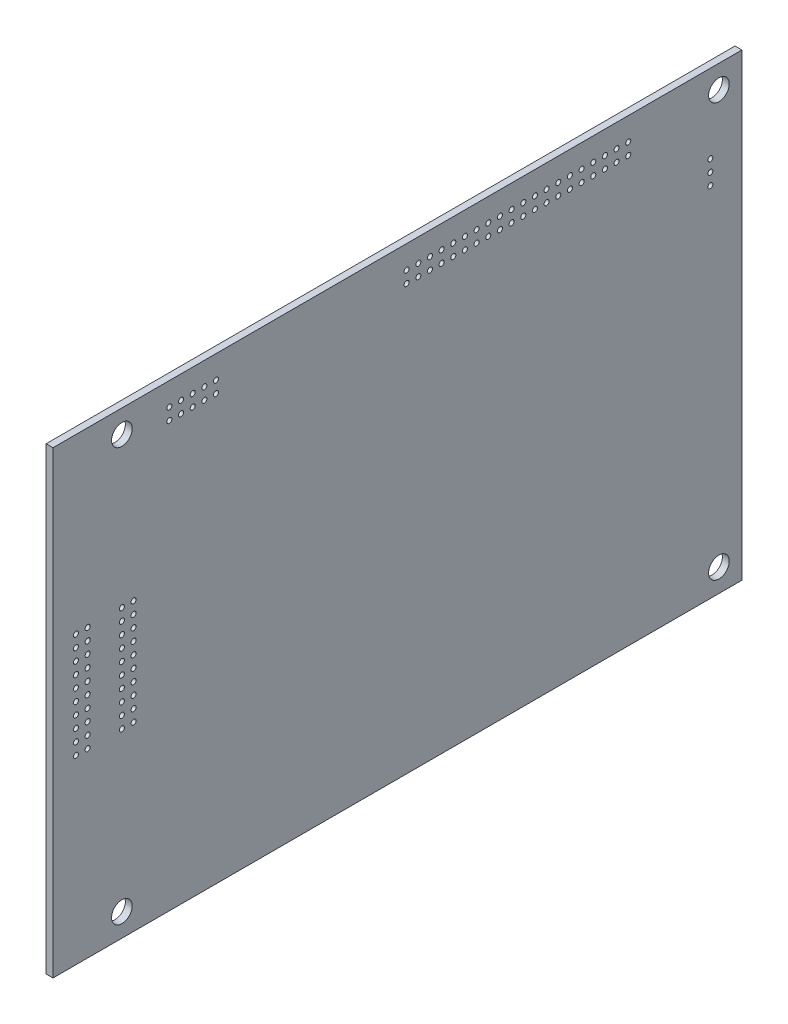
from build123d import *

# Parameters (mm, degrees)
SKETCH_1_W          = 150
SKETCH_1_H          = 100
SKETCH_1_R          = 2.25
EXTRUDE_1_DEPTH     = 1.5
SKETCH_2_R          = 0.55
CUT_EXTRUDE_1_DEPTH = 10


with BuildPart() as part:
    # Эскиз1 → Вытянуть1 (new body)
    with BuildSketch(Plane(origin=(0, 0, 0), x_dir=(0, 0, -1), z_dir=(1, 0, 0))):
        Rectangle(SKETCH_1_W, SKETCH_1_H)
        with Locations((-60, 45)):
            Circle(SKETCH_1_R, mode=Mode.SUBTRACT)
        with Locations((-60, -45)):
            Circle(SKETCH_1_R, mode=Mode.SUBTRACT)
        with Locations(Location((70, -45, 0), (0, 0, 180))):
            Circle(SKETCH_1_R, mode=Mode.SUBTRACT)
        with Locations(Location((70, 45, 0), (0, 0, 180))):
            Circle(SKETCH_1_R, mode=Mode.SUBTRACT)
    extrude(amount=EXTRUDE_1_DEPTH)

    # Эскиз2 → Вырез-Вытянуть1 (cut)
    with BuildSketch(Plane(origin=(1.5, 0, 0), x_dir=(0, 0, -1), z_dir=(1, 0, 0))):
        with Locations((-70, 12.335)):
            Circle(SKETCH_2_R)
        with Locations((-67.46, 12.335)):
            Circle(SKETCH_2_R)
        with Locations((-70, 9.795)):
            Circle(SKETCH_2_R)
        with Locations((-67.46, 9.795)):
            Circle(SKETCH_2_R)
        with Locations((-70, 7.255)):
            Circle(SKETCH_2_R)
        with Locations((-67.46, 7.255)):
            Circle(SKETCH_2_R)
        with Locations((-70, 4.715)):
            Circle(SKETCH_2_R)
        with Locations((-67.46, 4.715)):
            Circle(SKETCH_2_R)
        with Locations((-70, 2.175)):
            Circle(SKETCH_2_R)
        with Locations((-67.46, 2.175)):
            Circle(SKETCH_2_R)
        with Locations((-70, -0.365)):
            Circle(SKETCH_2_R)
        with Locations((-67.46, -0.365)):
            Circle(SKETCH_2_R)
        with Locations((-70, -2.905)):
            Circle(SKETCH_2_R)
        with Locations((-67.46, -2.905)):
            Circle(SKETCH_2_R)
        with Locations((-70, -5.445)):
            Circle(SKETCH_2_R)
        with Locations((-67.46, -5.445)):
            Circle(SKETCH_2_R)
        with Locations((-70, -7.985)):
            Circle(SKETCH_2_R)
        with Locations((-67.46, -7.985)):
            Circle(SKETCH_2_R)
        with Locations((-70, -10.525)):
            Circle(SKETCH_2_R)
        with Locations((-67.46, -10.525)):
            Circle(SKETCH_2_R)
        with Locations((-49.66, 45)):
            Circle(SKETCH_2_R)
        with Locations((-49.66, 42.46)):
            Circle(SKETCH_2_R)
        with Locations((-47.12, 45)):
            Circle(SKETCH_2_R)
        with Locations((-47.12, 42.46)):
            Circle(SKETCH_2_R)
        with Locations((-44.58, 45)):
            Circle(SKETCH_2_R)
        with Locations((-44.58, 42.46)):
            Circle(SKETCH_2_R)
        with Locations((-42.04, 45)):
            Circle(SKETCH_2_R)
        with Locations((-42.04, 42.46)):
            Circle(SKETCH_2_R)
        with Locations((-39.5, 45)):
            Circle(SKETCH_2_R)
        with Locations((-39.5, 42.46)):
            Circle(SKETCH_2_R)
        with Locations((2, 45)):
            Circle(SKETCH_2_R)
        with Locations((2, 42.46)):
            Circle(SKETCH_2_R)
        with Locations((4.54, 45)):
            Circle(SKETCH_2_R)
        with Locations((4.54, 42.46)):
            Circle(SKETCH_2_R)
        with Locations((7.08, 45)):
            Circle(SKETCH_2_R)
        with Locations((7.08, 42.46)):
            Circle(SKETCH_2_R)
        with Locations((9.62, 45)):
            Circle(SKETCH_2_R)
        with Locations((9.62, 42.46)):
            Circle(SKETCH_2_R)
        with Locations((12.16, 45)):
            Circle(SKETCH_2_R)
        with Locations((12.16, 42.46)):
            Circle(SKETCH_2_R)
        with Locations((14.7, 45)):
            Circle(SKETCH_2_R)
        with Locations((14.7, 42.46)):
            Circle(SKETCH_2_R)
        with Locations((17.24, 45)):
            Circle(SKETCH_2_R)
        with Locations((17.24, 42.46)):
            Circle(SKETCH_2_R)
        with Locations((19.78, 45)):
            Circle(SKETCH_2_R)
        with Locations((19.78, 42.46)):
            Circle(SKETCH_2_R)
        with Locations((22.32, 45)):
            Circle(SKETCH_2_R)
        with Locations((22.32, 42.46)):
            Circle(SKETCH_2_R)
        with Locations((24.86, 45)):
            Circle(SKETCH_2_R)
        with Locations((24.86, 42.46)):
            Circle(SKETCH_2_R)
        with Locations((27.4, 45)):
            Circle(SKETCH_2_R)
        with Locations((27.4, 42.46)):
            Circle(SKETCH_2_R)
        with Locations((29.94, 45)):
            Circle(SKETCH_2_R)
        with Locations((29.94, 42.46)):
            Circle(SKETCH_2_R)
        with Locations((32.48, 45)):
            Circle(SKETCH_2_R)
        with Locations((32.48, 42.46)):
            Circle(SKETCH_2_R)
        with Locations((35.02, 45)):
            Circle(SKETCH_2_R)
        with Locations((35.02, 42.46)):
            Circle(SKETCH_2_R)
        with Locations((37.56, 45)):
            Circle(SKETCH_2_R)
        with Locations((37.56, 42.46)):
            Circle(SKETCH_2_R)
        with Locations((40.1, 45)):
            Circle(SKETCH_2_R)
        with Locations((40.1, 42.46)):
            Circle(SKETCH_2_R)
        with Locations((42.64, 45)):
            Circle(SKETCH_2_R)
        with Locations((42.64, 42.46)):
            Circle(SKETCH_2_R)
        with Locations((45.18, 45)):
            Circle(SKETCH_2_R)
        with Locations((45.18, 42.46)):
            Circle(SKETCH_2_R)
        with Locations((47.72, 45)):
            Circle(SKETCH_2_R)
        with Locations((47.72, 42.46)):
            Circle(SKETCH_2_R)
        with Locations((50.26, 45)):
            Circle(SKETCH_2_R)
        with Locations((50.26, 42.46)):
            Circle(SKETCH_2_R)
        with Locations((68.125, 32.915)):
            Circle(SKETCH_2_R)
        with Locations((68.125, 30.375)):
            Circle(SKETCH_2_R)
        with Locations((68.125, 27.835)):
            Circle(SKETCH_2_R)
        with Locations((-60, 12.335)):
            Circle(SKETCH_2_R)
        with Locations((-57.46, 12.335)):
            Circle(SKETCH_2_R)
        with Locations((-60, 9.795)):
            Circle(SKETCH_2_R)
        with Locations((-57.46, 9.795)):
            Circle(SKETCH_2_R)
        with Locations((-60, 7.255)):
            Circle(SKETCH_2_R)
        with Locations((-57.46, 7.255)):
            Circle(SKETCH_2_R)
        with Locations((-60, 4.715)):
            Circle(SKETCH_2_R)
        with Locations((-57.46, 4.715)):
            Circle(SKETCH_2_R)
        with Locations((-60, 2.175)):
            Circle(SKETCH_2_R)
        with Locations((-57.46, 2.175)):
            Circle(SKETCH_2_R)
        with Locations((-60, -0.365)):
            Circle(SKETCH_2_R)
        with Locations((-57.46, -0.365)):
            Circle(SKETCH_2_R)
        with Locations((-60, -2.905)):
            Circle(SKETCH_2_R)
        with Locations((-57.46, -2.905)):
            Circle(SKETCH_2_R)
        with Locations((-60, -5.445)):
            Circle(SKETCH_2_R)
        with Locations((-57.46, -5.445)):
            Circle(SKETCH_2_R)
        with Locations((-60, -7.985)):
            Circle(SKETCH_2_R)
        with Locations((-57.46, -7.985)):
            Circle(SKETCH_2_R)
        with Locations((-60, -10.525)):
            Circle(SKETCH_2_R)
        with Locations((-57.46, -10.525)):
            Circle(SKETCH_2_R)
    extrude(amount=-CUT_EXTRUDE_1_DEPTH, mode=Mode.SUBTRACT)


solid = part.part
